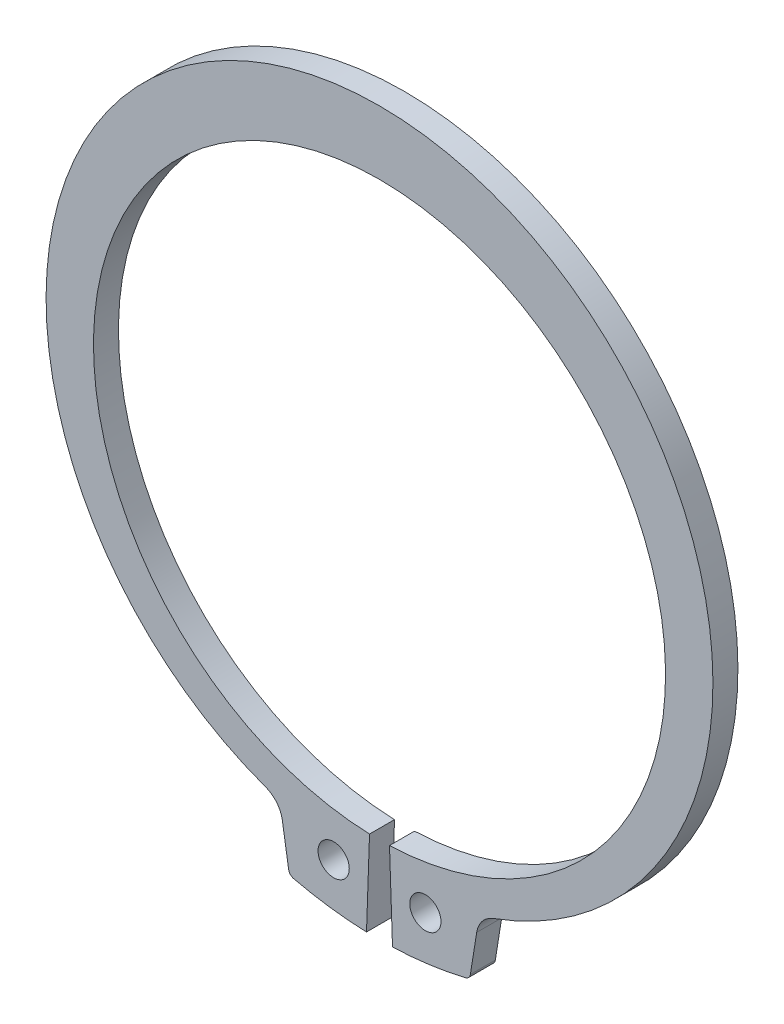
from build123d import *

# Parameters (mm, degrees)
SKETCH4_R           = 1.25
BOSS_EXTRUDE1_DEPTH = 1
FILLET1_R           = 2.095591987
FILLET2_R           = 0.523897997


with BuildPart() as part:
    # Sketch4 → Boss-Extrude1 (new, symmetric)
    with BuildSketch(Plane.XY):
        with BuildLine():
            Line((-7.218419511, -28.931252119), (-7.979505874, -24.166712354))
            ThreePointArc((-7.979505874, -24.166712354), (-26.386731475, 5.342522391), (0, 28))
            Line((0, 28), (0, 22.9))
            ThreePointArc((0, 22.9), (-22.896512219, 0.399660107), (-0.799198474, -22.886049939))
            Line((-0.799198474, -22.886049939), (-1.040638931, -29.8))
            ThreePointArc((-1.040638931, -29.8), (-4.152311682, -29.527635142), (-7.218419511, -28.931252119))
        make_face()
        with Locations((-3.670619139, -26.102256035)):
            Circle(SKETCH4_R, mode=Mode.SUBTRACT)
    extrude(amount=BOSS_EXTRUDE1_DEPTH, both=True)

    # Fillet1
    fillet1_edges = [part.edges().sort_by_distance(p)[0] for p in [
        (-7.979505874, -24.166712354, 0),
    ]]
    fillet(fillet1_edges, radius=FILLET1_R)

    # Fillet2
    fillet2_edges = [part.edges().sort_by_distance(p)[0] for p in [
        (-7.218419511, -28.931252119, 0),
    ]]
    fillet(fillet2_edges, radius=FILLET2_R)

    # Mirror1: part across plane


with BuildPart() as part_1:
    add(part.part)
    add(part.part.mirror(Plane(origin=(0, 28, 1), x_dir=(0, 0, 1), z_dir=(-1, 0, 0))))


solid = part_1.part
